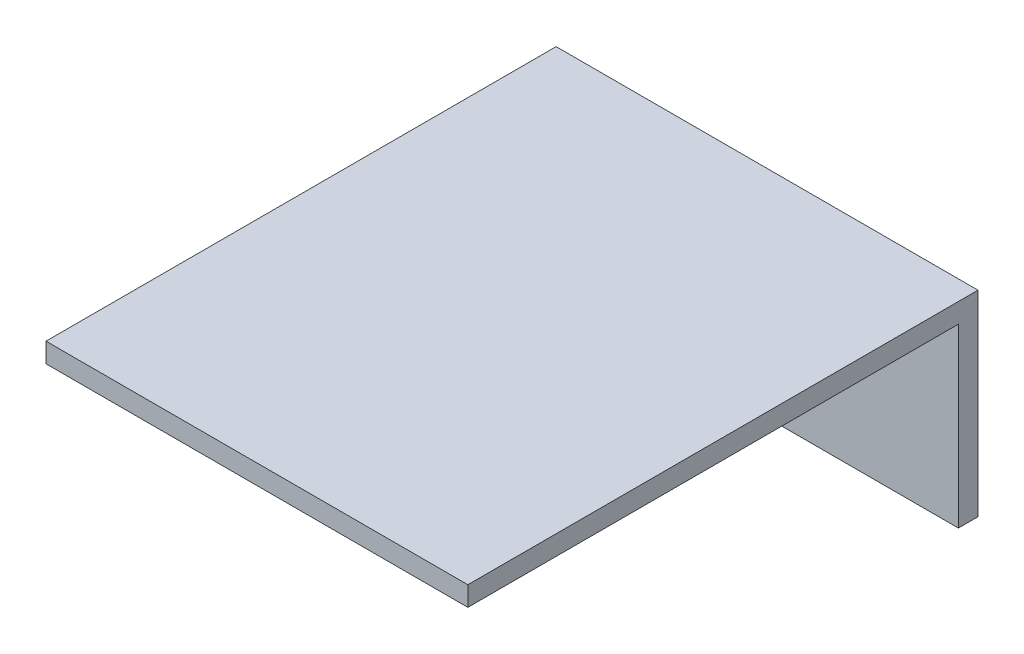
from build123d import *

# Parameters (mm, degrees)
ESQUISSE1_W             = 43
ESQUISSE1_H             = 20
BOSS_EXTRU_1_DEPTH      = 52
ESQUISSE2_W             = 57.277645312
ESQUISSE2_H             = 21.944309951
ENL_V_MAT_EXTRU_1_DEPTH = 50


with BuildPart() as part:
    # Esquisse1 → Boss.-Extru.1 (new body)
    with BuildSketch(Plane.XY):
        Rectangle(ESQUISSE1_W, ESQUISSE1_H)
    extrude(amount=BOSS_EXTRU_1_DEPTH)

    # Esquisse2 → Enlèv. mat.-Extru.1 (cut)
    with BuildSketch(Plane.XY.offset(52)):
        with Locations((1.570038745, -2.972154976)):
            Rectangle(ESQUISSE2_W, ESQUISSE2_H)
    extrude(amount=-ENL_V_MAT_EXTRU_1_DEPTH, mode=Mode.SUBTRACT)


solid = part.part
